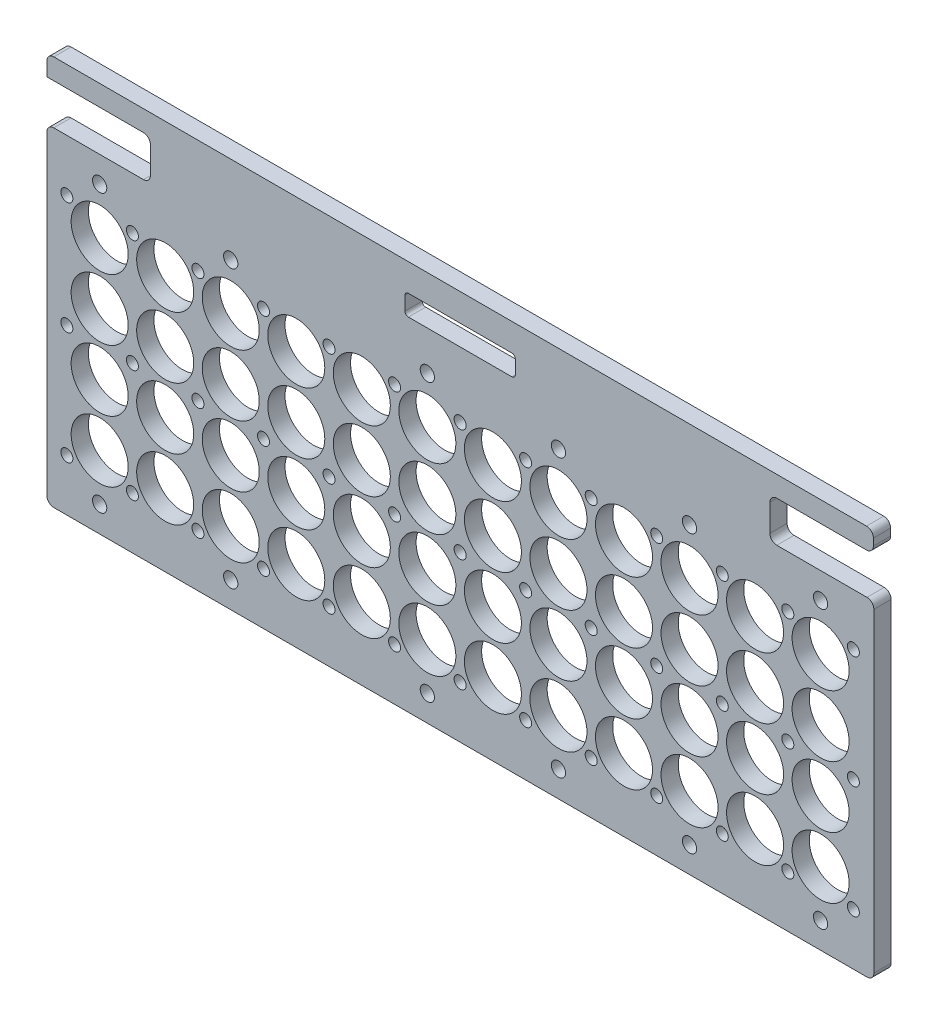
from build123d import *

# Parameters (mm, degrees)
SKETCH2_R           = 10.499946832
SKETCH2_R_2         = 2.625
BOSS_EXTRUDE1_DEPTH = 6.35
SKETCH3_R           = 2.2098
CUT_EXTRUDE1_DEPTH  = 301.354777645
BOSS_EXTRUDE3_DEPTH = 6.35
FILLET1_R           = 2.54
CUT_EXTRUDE2_DEPTH  = 309.215396357
FILLET3_R           = 1.27


with BuildPart() as part:
    # Sketch2 → Boss-Extrude1 (new body)
    with BuildSketch(Plane.XY):
        Polygon((-19.430000002, 91.526), (-19.430000002, -23.708), (-19.430000002, -26.629), (285.048126016, -26.629), (285.048126016, -23.708), (285.048126016, 91.526), (285.048126016, 94.447), (-19.430000002, 94.447), align=None)
        Circle(SKETCH2_R, mode=Mode.SUBTRACT)
        with Locations((24.13, 0)):
            Circle(SKETCH2_R, mode=Mode.SUBTRACT)
        with Locations((48.26, 0)):
            Circle(SKETCH2_R, mode=Mode.SUBTRACT)
        with Locations((72.39, 0)):
            Circle(SKETCH2_R, mode=Mode.SUBTRACT)
        with Locations((24.13, 22.606)):
            Circle(SKETCH2_R, mode=Mode.SUBTRACT)
        with Locations((48.26, 22.606)):
            Circle(SKETCH2_R, mode=Mode.SUBTRACT)
        with Locations((72.39, 22.606)):
            Circle(SKETCH2_R, mode=Mode.SUBTRACT)
        with Locations((24.13, 45.212)):
            Circle(SKETCH2_R, mode=Mode.SUBTRACT)
        with Locations((48.26, 45.212)):
            Circle(SKETCH2_R, mode=Mode.SUBTRACT)
        with Locations((72.39, 45.212)):
            Circle(SKETCH2_R, mode=Mode.SUBTRACT)
        with Locations((24.13, 67.818)):
            Circle(SKETCH2_R, mode=Mode.SUBTRACT)
        with Locations((48.26, 67.818)):
            Circle(SKETCH2_R, mode=Mode.SUBTRACT)
        with Locations((72.39, 67.818)):
            Circle(SKETCH2_R, mode=Mode.SUBTRACT)
        with Locations((0, 22.606)):
            Circle(SKETCH2_R, mode=Mode.SUBTRACT)
        with Locations((0, 45.212)):
            Circle(SKETCH2_R, mode=Mode.SUBTRACT)
        with Locations((0, 67.818)):
            Circle(SKETCH2_R, mode=Mode.SUBTRACT)
        with Locations((96.52, 0)):
            Circle(SKETCH2_R, mode=Mode.SUBTRACT)
        with Locations((120.65, 0)):
            Circle(SKETCH2_R, mode=Mode.SUBTRACT)
        with Locations((144.78, 0)):
            Circle(SKETCH2_R, mode=Mode.SUBTRACT)
        with Locations((168.91, 0)):
            Circle(SKETCH2_R, mode=Mode.SUBTRACT)
        with Locations((193.04, 0)):
            Circle(SKETCH2_R, mode=Mode.SUBTRACT)
        with Locations((217.17, 0)):
            Circle(SKETCH2_R, mode=Mode.SUBTRACT)
        with Locations((241.3, 0)):
            Circle(SKETCH2_R, mode=Mode.SUBTRACT)
        with Locations((265.43, 0)):
            Circle(SKETCH2_R, mode=Mode.SUBTRACT)
        with Locations((96.52, 22.606)):
            Circle(SKETCH2_R, mode=Mode.SUBTRACT)
        with Locations((120.65, 22.606)):
            Circle(SKETCH2_R, mode=Mode.SUBTRACT)
        with Locations((144.78, 22.606)):
            Circle(SKETCH2_R, mode=Mode.SUBTRACT)
        with Locations((168.91, 22.606)):
            Circle(SKETCH2_R, mode=Mode.SUBTRACT)
        with Locations((193.04, 22.606)):
            Circle(SKETCH2_R, mode=Mode.SUBTRACT)
        with Locations((217.17, 22.606)):
            Circle(SKETCH2_R, mode=Mode.SUBTRACT)
        with Locations((241.3, 22.606)):
            Circle(SKETCH2_R, mode=Mode.SUBTRACT)
        with Locations((265.43, 22.606)):
            Circle(SKETCH2_R, mode=Mode.SUBTRACT)
        with Locations((96.52, 45.212)):
            Circle(SKETCH2_R, mode=Mode.SUBTRACT)
        with Locations((120.65, 45.212)):
            Circle(SKETCH2_R, mode=Mode.SUBTRACT)
        with Locations((144.78, 45.212)):
            Circle(SKETCH2_R, mode=Mode.SUBTRACT)
        with Locations((168.91, 45.212)):
            Circle(SKETCH2_R, mode=Mode.SUBTRACT)
        with Locations((193.04, 45.212)):
            Circle(SKETCH2_R, mode=Mode.SUBTRACT)
        with Locations((217.17, 45.212)):
            Circle(SKETCH2_R, mode=Mode.SUBTRACT)
        with Locations((241.3, 45.212)):
            Circle(SKETCH2_R, mode=Mode.SUBTRACT)
        with Locations((265.43, 45.212)):
            Circle(SKETCH2_R, mode=Mode.SUBTRACT)
        with Locations((96.52, 67.818)):
            Circle(SKETCH2_R, mode=Mode.SUBTRACT)
        with Locations((120.65, 67.818)):
            Circle(SKETCH2_R, mode=Mode.SUBTRACT)
        with Locations((144.78, 67.818)):
            Circle(SKETCH2_R, mode=Mode.SUBTRACT)
        with Locations((168.91, 67.818)):
            Circle(SKETCH2_R, mode=Mode.SUBTRACT)
        with Locations((193.04, 67.818)):
            Circle(SKETCH2_R, mode=Mode.SUBTRACT)
        with Locations((217.17, 67.818)):
            Circle(SKETCH2_R, mode=Mode.SUBTRACT)
        with Locations((241.3, 67.818)):
            Circle(SKETCH2_R, mode=Mode.SUBTRACT)
        with Locations((265.43, 67.818)):
            Circle(SKETCH2_R, mode=Mode.SUBTRACT)
        with Locations((0, 84.921973416)):
            Circle(SKETCH2_R_2, mode=Mode.SUBTRACT)
        with Locations((48.26, 84.921973416)):
            Circle(SKETCH2_R_2, mode=Mode.SUBTRACT)
        with Locations((217.17, 84.921973416)):
            Circle(SKETCH2_R_2, mode=Mode.SUBTRACT)
        with Locations((265.43, 84.921973416)):
            Circle(SKETCH2_R_2, mode=Mode.SUBTRACT)
        with Locations((120.65, 84.921973416)):
            Circle(SKETCH2_R_2, mode=Mode.SUBTRACT)
        with Locations((168.91, 84.921973416)):
            Circle(SKETCH2_R_2, mode=Mode.SUBTRACT)
        with Locations(Location((265.43, -17.103973416, 0), (0, 0, 180))):
            Circle(SKETCH2_R_2, mode=Mode.SUBTRACT)
        with Locations(Location((217.17, -17.103973416, 0), (0, 0, 180))):
            Circle(SKETCH2_R_2, mode=Mode.SUBTRACT)
        with Locations(Location((48.26, -17.103973416, 0), (0, 0, 180))):
            Circle(SKETCH2_R_2, mode=Mode.SUBTRACT)
        with Locations(Location((0, -17.103973416, 0), (0, 0, 180))):
            Circle(SKETCH2_R_2, mode=Mode.SUBTRACT)
        with Locations(Location((168.91, -17.103973416, 0), (0, 0, 180))):
            Circle(SKETCH2_R_2, mode=Mode.SUBTRACT)
        with Locations(Location((120.65, -17.103973416, 0), (0, 0, 180))):
            Circle(SKETCH2_R_2, mode=Mode.SUBTRACT)
    extrude(amount=BOSS_EXTRUDE1_DEPTH)

    # Sketch3 → Cut-Extrude1 (cut, through all)
    with BuildSketch(Plane.XY.offset(6.35)):
        with Locations((12.065, 75.355240112)):
            Circle(SKETCH3_R)
        with Locations(Location((12.065, -7.537240112, 0), (0, 0, 180))):
            Circle(SKETCH3_R)
        with Locations((36.195, 75.355240112)):
            Circle(SKETCH3_R)
        with Locations((60.325, 75.355240112)):
            Circle(SKETCH3_R)
        with Locations((84.455, 75.355240112)):
            Circle(SKETCH3_R)
        with Locations((108.585, 75.355240112)):
            Circle(SKETCH3_R)
        with Locations((132.715, 75.355240112)):
            Circle(SKETCH3_R)
        with Locations((156.845, 75.355240112)):
            Circle(SKETCH3_R)
        with Locations((180.975, 75.355240112)):
            Circle(SKETCH3_R)
        with Locations((205.105, 75.355240112)):
            Circle(SKETCH3_R)
        with Locations((229.235, 75.355240112)):
            Circle(SKETCH3_R)
        with Locations((253.365, 75.355240112)):
            Circle(SKETCH3_R)
        with Locations((277.495, 75.355240112)):
            Circle(SKETCH3_R)
        with Locations((-12.065, 75.355240112)):
            Circle(SKETCH3_R)
        with Locations(Location((277.495, -7.537240112, 0), (0, 0, 180))):
            Circle(SKETCH3_R)
        with Locations(Location((253.365, -7.537240112, 0), (0, 0, 180))):
            Circle(SKETCH3_R)
        with Locations(Location((229.235, -7.537240112, 0), (0, 0, 180))):
            Circle(SKETCH3_R)
        with Locations(Location((205.105, -7.537240112, 0), (0, 0, 180))):
            Circle(SKETCH3_R)
        with Locations(Location((180.975, -7.537240112, 0), (0, 0, 180))):
            Circle(SKETCH3_R)
        with Locations(Location((156.845, -7.537240112, 0), (0, 0, 180))):
            Circle(SKETCH3_R)
        with Locations(Location((132.715, -7.537240112, 0), (0, 0, 180))):
            Circle(SKETCH3_R)
        with Locations(Location((108.585, -7.537240112, 0), (0, 0, 180))):
            Circle(SKETCH3_R)
        with Locations(Location((84.455, -7.537240112, 0), (0, 0, 180))):
            Circle(SKETCH3_R)
        with Locations(Location((60.325, -7.537240112, 0), (0, 0, 180))):
            Circle(SKETCH3_R)
        with Locations(Location((36.195, -7.537240112, 0), (0, 0, 180))):
            Circle(SKETCH3_R)
        with Locations(Location((-12.065, -7.537240112, 0), (0, 0, 180))):
            Circle(SKETCH3_R)
        with Locations((12.065, 33.909)):
            Circle(SKETCH3_R)
        with Locations((36.195, 33.909)):
            Circle(SKETCH3_R)
        with Locations((60.325, 33.909)):
            Circle(SKETCH3_R)
        with Locations((84.455, 33.909)):
            Circle(SKETCH3_R)
        with Locations((108.585, 33.909)):
            Circle(SKETCH3_R)
        with Locations((132.715, 33.909)):
            Circle(SKETCH3_R)
        with Locations((156.845, 33.909)):
            Circle(SKETCH3_R)
        with Locations((180.975, 33.909)):
            Circle(SKETCH3_R)
        with Locations((205.105, 33.909)):
            Circle(SKETCH3_R)
        with Locations((229.235, 33.909)):
            Circle(SKETCH3_R)
        with Locations((253.365, 33.909)):
            Circle(SKETCH3_R)
        with Locations((277.495, 33.909)):
            Circle(SKETCH3_R)
        with Locations((-12.065, 33.909)):
            Circle(SKETCH3_R)
    extrude(amount=-CUT_EXTRUDE1_DEPTH, mode=Mode.SUBTRACT)

    # Sketch7 → Boss-Extrude3 (add, through all)
    with BuildSketch(Plane.XY.offset(6.35)):
        Polygon((246.760000082, 93.177000044), (18.670000078, 93.177000044), (18.670000078, 109.443973562), (-19.429999922, 109.443973562), (-19.429999922, 117.063973562), (284.860000082, 117.063973562), (284.860000082, 109.443973562), (246.760000082, 109.443973562), align=None)
    extrude(amount=-BOSS_EXTRUDE3_DEPTH)

    # Fillet1
    fillet1_edges = [part.edges().sort_by_distance(p)[0] for p in [
        (-19.430000002, 94.447, 3.175),
        (285.048126016, 94.447, 3.175),
        (285.048126016, -26.629, 3.175),
        (-19.430000002, -26.629, 3.175),
        (18.670000078, 94.447, 3.175),
        (246.760000082, 94.447, 3.175),
        (246.760000082, 109.443973562, 3.175),
        (18.670000078, 109.443973562, 3.175),
        (-19.429999922, 117.063973562, 3.175),
        (284.860000082, 117.063973562, 3.175),
        (284.860000082, 109.443973562, 3.175),
    ]]
    fillet(fillet1_edges, radius=FILLET1_R)

    # Sketch10 → Cut-Extrude2 (cut, through all)
    with BuildSketch(Plane.XY.offset(6.35)):
        Polygon((132.71500008, 106.961583302), (153.03500008, 106.961583302), (153.03500008, 99.391583202), (112.39500008, 99.391583202), (112.39500008, 106.961583302), align=None)
    extrude(amount=-CUT_EXTRUDE2_DEPTH, mode=Mode.SUBTRACT)

    # Fillet3
    fillet3_edges = [part.edges().sort_by_distance(p)[0] for p in [
        (112.39500008, 106.961583302, 3.175),
        (153.03500008, 106.961583302, 3.175),
        (153.03500008, 99.391583202, 3.175),
        (112.39500008, 99.391583202, 3.175),
    ]]
    fillet(fillet3_edges, radius=FILLET3_R)


solid = part.part
